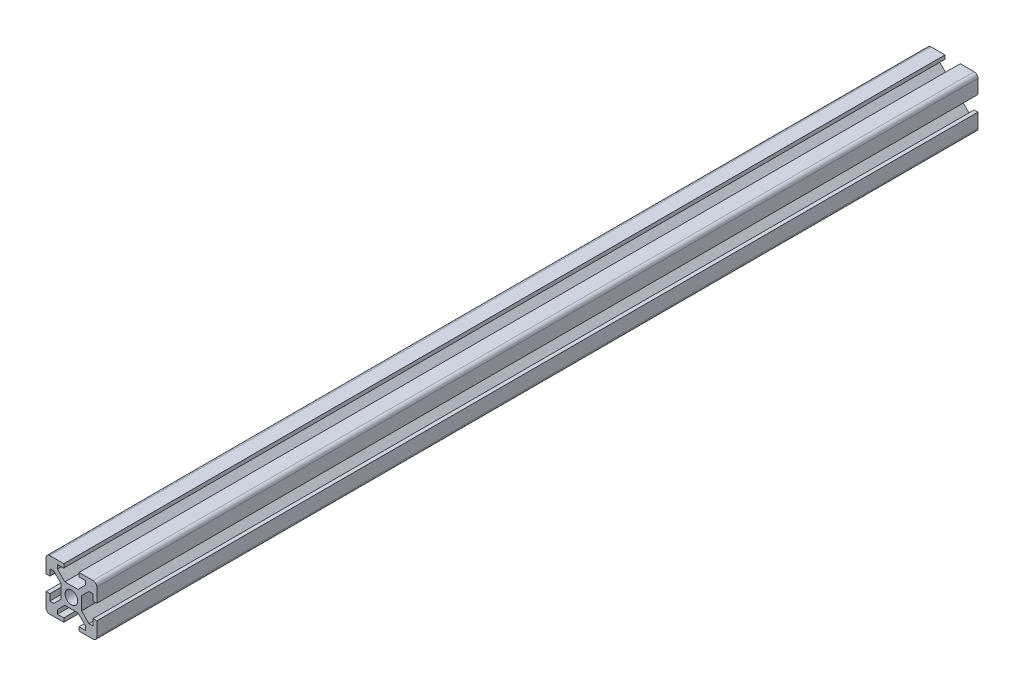
from build123d import *

# Parameters (mm, degrees)
SKETCH1_R           = 2.5
BOSS_EXTRUDE1_DEPTH = 347


with BuildPart() as part:
    # Sketch1 → Boss-Extrude1 (new body)
    with BuildSketch(Plane.XY):
        with BuildLine():
            Line((-2.585786438, 4), (-5.5, 6.914213562))
            Line((-5.5, 6.914213562), (-5.5, 8.5))
            Line((-5.5, 8.5), (-3, 8.5))
            Line((-3, 8.5), (-3, 10))
            Line((-3, 10), (-8.5, 10))
            ThreePointArc((-8.5, 10), (-9.560660172, 9.560660172), (-10, 8.5))
            Line((-10, 8.5), (-10, 3))
            Line((-10, 3), (-8.5, 3))
            Line((-8.5, 3), (-8.5, 5.5))
            Line((-8.5, 5.5), (-6.914213562, 5.5))
            Line((-6.914213562, 5.5), (-4, 2.585786438))
            Line((-4, 2.585786438), (-4, -2.585786438))
            Line((-4, -2.585786438), (-6.914213562, -5.5))
            Line((-6.914213562, -5.5), (-8.5, -5.5))
            Line((-8.5, -5.5), (-8.5, -3))
            Line((-8.5, -3), (-10, -3))
            Line((-10, -3), (-10, -8.5))
            ThreePointArc((-10, -8.5), (-9.560660172, -9.560660172), (-8.5, -10))
            Line((-8.5, -10), (-3, -10))
            Line((-3, -10), (-3, -8.5))
            Line((-3, -8.5), (-5.5, -8.5))
            Line((-5.5, -8.5), (-5.5, -6.914213562))
            Line((-5.5, -6.914213562), (-2.585786438, -4))
            Line((-2.585786438, -4), (2.585786438, -4))
            Line((2.585786438, -4), (5.5, -6.914213562))
            Line((5.5, -6.914213562), (5.5, -8.5))
            Line((5.5, -8.5), (3, -8.5))
            Line((3, -8.5), (3, -10))
            Line((3, -10), (8.5, -10))
            ThreePointArc((8.5, -10), (9.560660172, -9.560660172), (10, -8.5))
            Line((10, -8.5), (10, -3))
            Line((10, -3), (8.5, -3))
            Line((8.5, -3), (8.5, -5.5))
            Line((8.5, -5.5), (6.914213562, -5.5))
            Line((6.914213562, -5.5), (4, -2.585786438))
            Line((4, -2.585786438), (4, 2.585786438))
            Line((4, 2.585786438), (6.914213562, 5.5))
            Line((6.914213562, 5.5), (8.5, 5.5))
            Line((8.5, 5.5), (8.5, 3))
            Line((8.5, 3), (10, 3))
            Line((10, 3), (10, 8.5))
            ThreePointArc((10, 8.5), (9.560660172, 9.560660172), (8.5, 10))
            Line((8.5, 10), (3, 10))
            Line((3, 10), (3, 8.5))
            Line((3, 8.5), (5.5, 8.5))
            Line((5.5, 8.5), (5.5, 6.914213562))
            Line((5.5, 6.914213562), (2.585786438, 4))
            Line((2.585786438, 4), (-2.585786438, 4))
        make_face()
        Circle(SKETCH1_R, mode=Mode.SUBTRACT)
    extrude(amount=BOSS_EXTRUDE1_DEPTH)


solid = part.part
